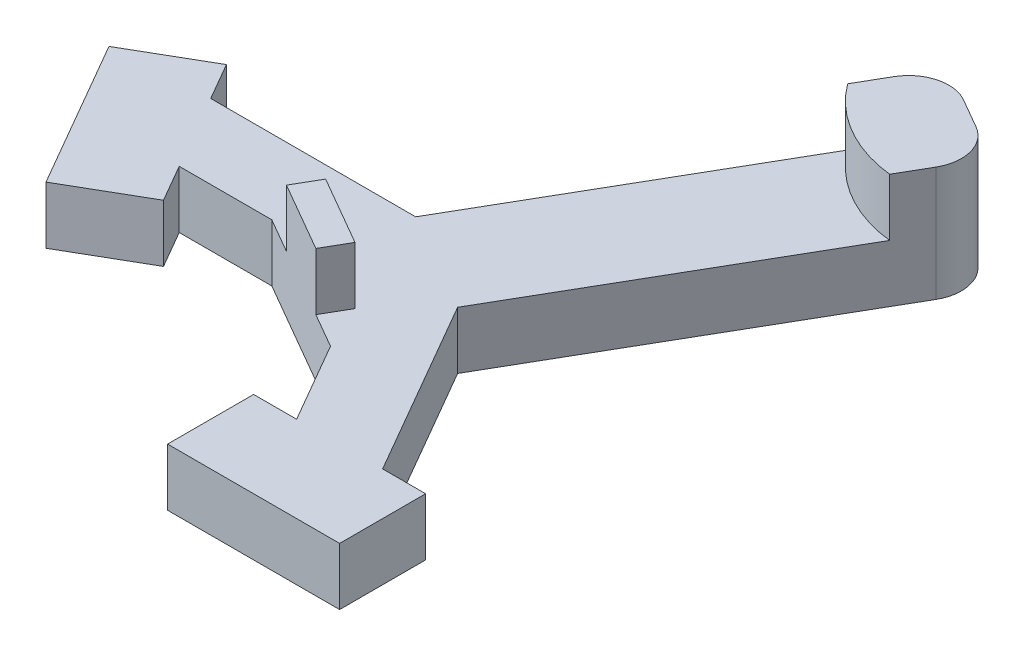
from build123d import *

# Parameters (mm, degrees)
EXTRUDE_1_DEPTH = 10
EXTRUDE_2_DEPTH = 10
EXTRUDE_4_DEPTH = 10
FILLET_1_R      = 7


with BuildPart() as part:
    # 草图2 → 凸台-拉伸1 (new body)
    with BuildSketch(Plane(origin=(0, 0, 0), x_dir=(1, 0, 0), z_dir=(0, 1, 0))):
        Polygon((-20.179491924, 74.951905284), (-5.179491924, 48.97114317), (7.810889132, 56.47114317), (4.060889132, 62.966333699), (20.207259422, 62.966333699), (44.426814855, 48.983166849), (52.5, 35), (45, 35), (45, 20), (75, 20), (75, 35), (67.5, 35), (49.627132403, 65.956714755), (83.660254038, 124.903810568), (66.339745962, 134.903810568), (32.306624327, 75.956714755), (-3.439110868, 75.956714755), (-7.189110868, 82.451905284), align=None)
    extrude(amount=EXTRUDE_1_DEPTH)

    # 草图3 → 凸台-拉伸2 (add)
    with BuildSketch(Plane(origin=(0, 10, 0), x_dir=(1, 0, 0), z_dir=(0, 1, 0))):
        with BuildLine():
            Line((66.339745962, 134.903810568), (59.883306725, 123.720929773))
            ThreePointArc((59.883306725, 123.720929773), (67.5, 116.913429511), (77.2038148, 113.720929773))
            Line((77.2038148, 113.720929773), (83.660254038, 124.903810568))
            Line((83.660254038, 124.903810568), (66.339745962, 134.903810568))
        make_face()
    extrude(amount=EXTRUDE_2_DEPTH)

    # 草图5 → 凸台-拉伸4 (add)
    with BuildSketch(Plane(origin=(0, 10, 0), x_dir=(1, 0, 0), z_dir=(0, 1, 0))):
        Polygon((38.379214965, 52.474750274), (40.879214965, 56.804877293), (28.754859312, 63.804877293), (26.254859312, 59.474750274), align=None)
    extrude(amount=EXTRUDE_4_DEPTH)

    # 圆角1
    fillet_1_edges = [part.edges().sort_by_distance(p)[0] for p in [
        (66.339745962, 10, -134.903810568),
        (83.660254038, 10, -124.903810568),
    ]]
    fillet(fillet_1_edges, radius=FILLET_1_R)


solid = part.part
